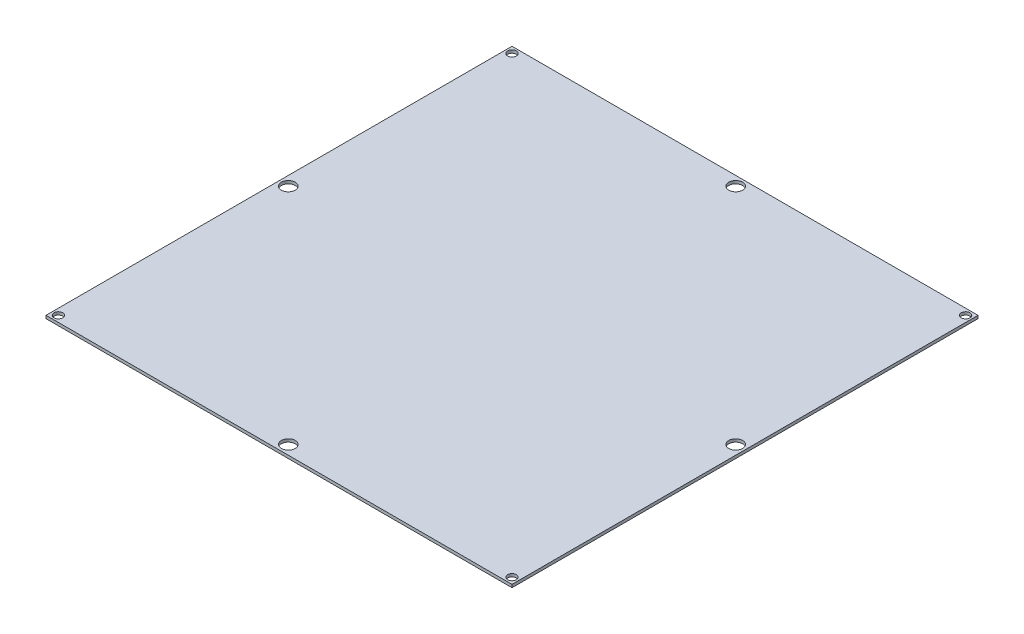
from build123d import *

# Parameters (mm, degrees)
SKETCH1_W           = 190.5
SKETCH1_H           = 190.5
SKETCH1_R           = 1.796
SKETCH1_R_2         = 2.84
BOSS_EXTRUDE1_DEPTH = 1.2


with BuildPart() as part:
    # Sketch1 → Boss-Extrude1 (new body)
    with BuildSketch(Plane(origin=(0, 0, 0), x_dir=(1, 0, 0), z_dir=(0, 1, 0))):
        with Locations((95.25, 95.25)):
            Rectangle(SKETCH1_W, SKETCH1_H)
        with Locations(Location((2.54, 187.96, 0), (0, 0, 270))):
            Circle(SKETCH1_R, mode=Mode.SUBTRACT)
        with Locations(Location((187.96, 187.96, 0), (0, 0, 270))):
            Circle(SKETCH1_R, mode=Mode.SUBTRACT)
        with Locations(Location((187.96, 2.54, 0), (0, 0, 270))):
            Circle(SKETCH1_R, mode=Mode.SUBTRACT)
        with Locations(Location((2.54, 2.54, 0), (0, 0, 270))):
            Circle(SKETCH1_R, mode=Mode.SUBTRACT)
        with Locations(Location((95.25, 186.69, 0), (0, 0, 270))):
            Circle(SKETCH1_R_2, mode=Mode.SUBTRACT)
        with Locations(Location((3.81, 95.25, 0), (0, 0, 270))):
            Circle(SKETCH1_R_2, mode=Mode.SUBTRACT)
        with Locations(Location((95.25, 3.81, 0), (0, 0, 90))):
            Circle(SKETCH1_R_2, mode=Mode.SUBTRACT)
        with Locations(Location((186.69, 95.25, 0), (0, 0, 90))):
            Circle(SKETCH1_R_2, mode=Mode.SUBTRACT)
    extrude(amount=BOSS_EXTRUDE1_DEPTH)


solid = part.part
